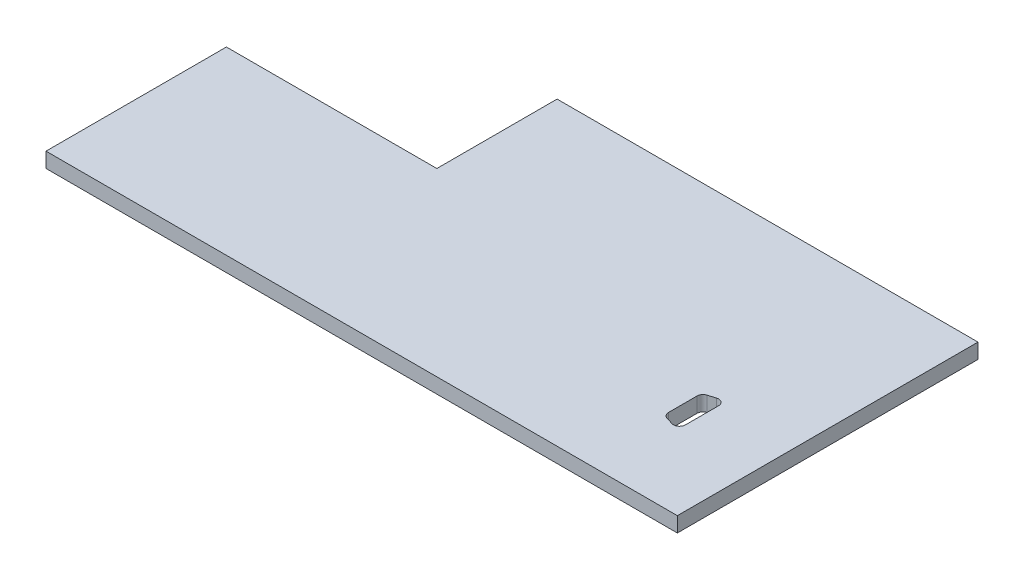
from build123d import *

# Parameters (mm, degrees)
BOSS_EXTRUDE1_DEPTH = 6.35
BOSS_EXTRUDE2_DEPTH = 11.43
CUT_EXTRUDE1_DEPTH  = 12.7
FILLET1_R           = 2.54


with BuildPart() as part:
    # Sketch1 → Boss-Extrude1 (new body)
    with BuildSketch(Plane(origin=(0, 0, 0), x_dir=(1, 0, 0), z_dir=(0, 1, 0))):
        Polygon((0, 0), (0, 76.2), (88.9, 76.2), (88.9, 127), (266.7, 127), (266.7, 0), align=None)
    extrude(amount=BOSS_EXTRUDE1_DEPTH)

    # Sketch2 → Boss-Extrude2 (add)
    with BuildSketch(Plane(origin=(0, 6.35, 0), x_dir=(1, 0, 0), z_dir=(0, 1, 0))):
        Polygon((19.05, 63.5), (101.6, 63.5), (101.6, 107.95), (88.9, 107.95), (88.9, 76.2), (19.05, 76.2), align=None)
    extrude(amount=-BOSS_EXTRUDE2_DEPTH)

    # Sketch3 → Cut-Extrude1 (cut)
    with BuildSketch(Plane(origin=(0, 6.35, 0), x_dir=(1, 0, 0), z_dir=(0, 1, 0))):
        Polygon((235.204, 31.496), (235.204, 52.324), (227.076, 49.784), (227.076, 34.036), align=None)
    extrude(amount=-CUT_EXTRUDE1_DEPTH, mode=Mode.SUBTRACT)

    # Fillet1
    fillet1_edges = [part.edges().sort_by_distance(p)[0] for p in [
        (235.204, 3.175, -31.496),
        (227.076, 3.175, -34.036),
        (227.076, 3.175, -49.784),
        (235.204, 3.175, -52.324),
    ]]
    fillet(fillet1_edges, radius=FILLET1_R)


solid = part.part
